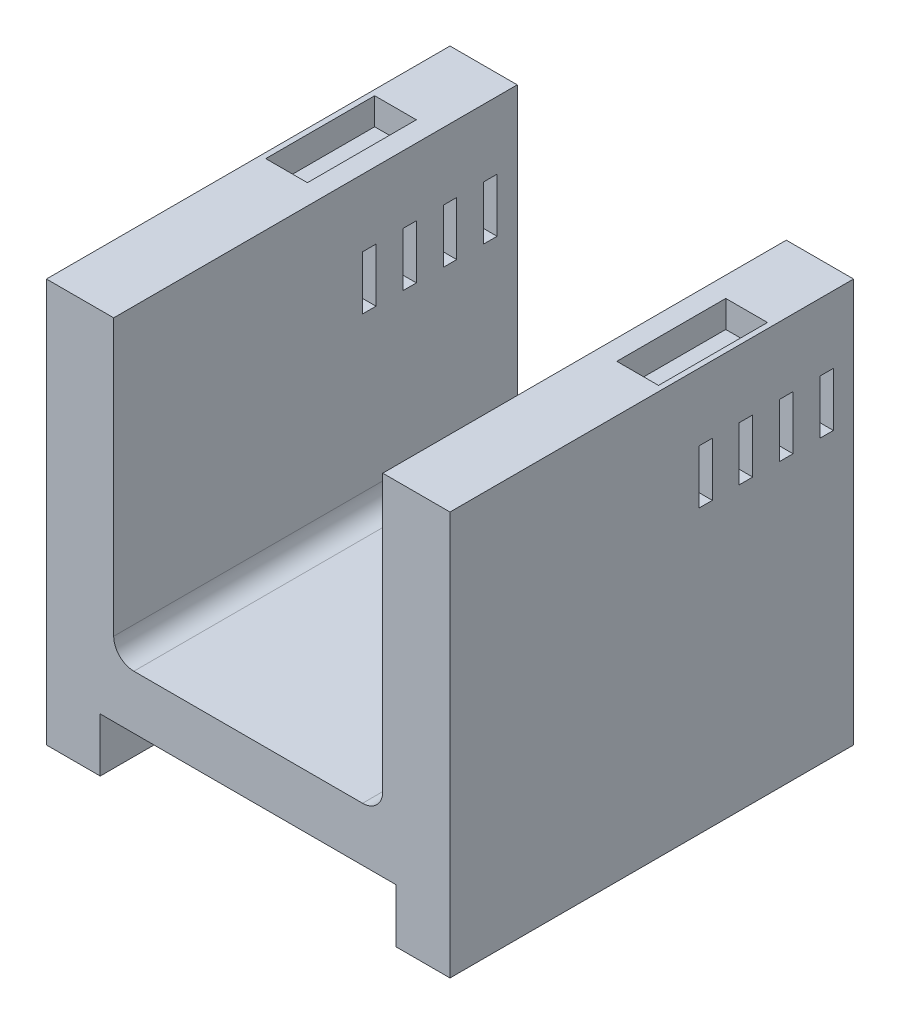
from build123d import *

# Parameters (mm, degrees)
SKETCH1_W           = 150
SKETCH1_H           = 150
BOSS_EXTRUDE2_DEPTH = 75
SKETCH2_W           = 110
SKETCH2_H           = 20
SKETCH2_W_2         = 100
SKETCH2_H_2         = 110
CUT_EXTRUDE1_DEPTH  = 150
SKETCH3_W           = 15.5
SKETCH3_H           = 40.5
CUT_EXTRUDE2_DEPTH  = 10
FILLET1_R           = 7.5
SKETCH4_W           = 5
SKETCH4_H           = 20
CUT_EXTRUDE3_DEPTH  = 140
CUT_EXTRUDE4_DEPTH  = 1


with BuildPart() as part:
    # Sketch1 → Boss-Extrude2 (new, symmetric)
    with BuildSketch(Plane.XY):
        Rectangle(SKETCH1_W, SKETCH1_H)
    extrude(amount=BOSS_EXTRUDE2_DEPTH, both=True)

    # Sketch2 → Cut-Extrude1 (cut)
    with BuildSketch(Plane.XY.offset(75)):
        with Locations((0, -65)):
            Rectangle(SKETCH2_W, SKETCH2_H)
        with Locations((0, 20)):
            Rectangle(SKETCH2_W_2, SKETCH2_H_2)
    extrude(amount=-CUT_EXTRUDE1_DEPTH, mode=Mode.SUBTRACT)

    # Sketch3 → Cut-Extrude2 (cut)
    with BuildSketch(Plane(origin=(0, 75, 0), x_dir=(1, 0, 0), z_dir=(0, 1, 0))):
        with Locations((-65.25, 24.75)):
            Rectangle(SKETCH3_W, SKETCH3_H)
        with Locations((65.25, 24.75)):
            Rectangle(SKETCH3_W, SKETCH3_H)
    extrude(amount=-CUT_EXTRUDE2_DEPTH, mode=Mode.SUBTRACT)

    # Fillet1
    fillet1_edges = [part.edges().sort_by_distance(p)[0] for p in [
        (-50, -35, 0),
        (50, -35, 0),
    ]]
    fillet(fillet1_edges, radius=FILLET1_R)

    # Sketch4 → Cut-Extrude3 (cut)
    with BuildSketch(Plane(origin=(75, 0, 0), x_dir=(0, 0, -1), z_dir=(1, 0, 0))):
        with Locations((50, 40)):
            Rectangle(SKETCH4_W, SKETCH4_H)
        with Locations((65, 40)):
            Rectangle(SKETCH4_W, SKETCH4_H)
        with Locations((35, 40)):
            Rectangle(SKETCH4_W, SKETCH4_H)
        with Locations((20, 40)):
            Rectangle(SKETCH4_W, SKETCH4_H)
    extrude(amount=-CUT_EXTRUDE3_DEPTH, mode=Mode.SUBTRACT)

    # Sketch5 → Cut-Extrude4 (cut)
    # profile 1 of 3: a face of its own
    with BuildSketch(Plane.ZY.offset(75)):
        with BuildLine():
            Line((-3.541666667, 5.069444444), (-3.402777778, 3.333333333))
            Line((-3.402777778, 3.333333333), (-3.541666667, 3.333333333))
            add(Edge.make_bspline(
                [(-3.541666667, 3.333333333), (-3.560127797, 3.399019648), (-3.595893554, 3.526277332), (-3.659666525, 3.708188694), (-3.72687542, 3.876622986), (-3.80227413, 4.030002755), (-3.882169582, 4.169862856), (-3.969191355, 4.294933132), (-4.061446842, 4.406359345), (-4.159647569, 4.503713276), (-4.263693084, 4.587758073), (-4.372377784, 4.660574141), (-4.485902518, 4.72297205), (-4.604543404, 4.774290321), (-4.728887016, 4.813670152), (-4.858484508, 4.839782023), (-4.992585977, 4.858539417), (-5.083844223, 4.860244724), (-5.130208333, 4.861111111)],
                knots=[0, 0, 0, 0, 1.365306606, 2.645083058, 3.856296657, 4.992683601, 6.063002854, 7.077131597, 8.038305781, 8.954596039, 9.839848101, 10.711227855, 11.569763097, 12.429061007, 13.294496621, 14.174761977, 15.072680662, 16, 16, 16, 16], degree=3))
            add(Edge.make_bspline(
                [(-5.130208333, 4.861111111), (-5.169287844, 4.860089442), (-5.246507093, 4.858070671), (-5.360883492, 4.847678613), (-5.472048479, 4.8275014), (-5.580824898, 4.801086562), (-5.686129552, 4.764183666), (-5.789791277, 4.722690801), (-5.889530348, 4.671063555), (-5.986658971, 4.612448815), (-6.079895988, 4.545370393), (-6.168442528, 4.469056114), (-6.250695552, 4.382880321), (-6.328676248, 4.287686666), (-6.400174828, 4.182334195), (-6.469732236, 4.069550336), (-6.530813132, 3.945799573), (-6.588653986, 3.813990541), (-6.639210104, 3.672821607), (-6.683765793, 3.523606878), (-6.721903181, 3.366486083), (-6.751481957, 3.200376693), (-6.777442138, 3.026490305), (-6.79218997, 2.843423536), (-6.804207347, 2.652791522), (-6.805100567, 2.522808163), (-6.805555556, 2.456597222)],
                knots=[0, 0, 0, 0, 0.852545564, 1.684589362, 2.501652392, 3.314783632, 4.123040609, 4.933143274, 5.748109165, 6.569312519, 7.405645712, 8.25016084, 9.114918083, 10.000754889, 10.930732154, 11.889927012, 12.888317242, 13.937610583, 15.028084188, 16.156171809, 17.332859433, 18.552090647, 19.835038534, 21.165583881, 22.556204723, 24, 24, 24, 24], degree=3))
            add(Edge.make_bspline(
                [(-6.805555556, 2.456597222), (-6.804946869, 2.401605833), (-6.803748531, 2.293342773), (-6.793819055, 2.134039228), (-6.777574592, 1.980162537), (-6.754944485, 1.832039691), (-6.726034828, 1.689130362), (-6.688544954, 1.552541535), (-6.646524944, 1.420863258), (-6.598146101, 1.294702841), (-6.541430788, 1.175857854), (-6.479663213, 1.062934068), (-6.410200288, 0.957804512), (-6.33376384, 0.859723869), (-6.2514189, 0.768334354), (-6.162155265, 0.684467281), (-6.066030391, 0.608356468), (-5.964210791, 0.538953857), (-5.856940358, 0.477090531), (-5.745110622, 0.42395381), (-5.629592775, 0.379544139), (-5.510746875, 0.342424594), (-5.388278397, 0.313039481), (-5.261719437, 0.292415184), (-5.131523556, 0.28051361), (-5.043426681, 0.278696094), (-4.998914931, 0.277777778)],
                knots=[0, 0, 0, 0, 1.236646645, 2.434620225, 3.588021171, 4.71542926, 5.803413575, 6.864987612, 7.89909351, 8.911178466, 9.900886288, 10.858450138, 11.803739474, 12.731186558, 13.652621421, 14.567606934, 15.482266978, 16.407285251, 17.336514176, 18.264317902, 19.188799549, 20.117565524, 21.062609844, 22.018756131, 22.998958452, 24, 24, 24, 24], degree=3))
            add(Edge.make_bspline(
                [(-4.998914931, 0.277777778), (-4.922799118, 0.27985346), (-4.773966265, 0.283912139), (-4.557884156, 0.321965574), (-4.355251978, 0.382410079), (-4.196194366, 0.454594439), (-4.074860643, 0.528837328), (-3.980806535, 0.595266272), (-3.885754729, 0.675090232), (-3.787987089, 0.766393808), (-3.688371129, 0.870218925), (-3.584882083, 0.98478028), (-3.481463369, 1.113194093), (-3.413030322, 1.203524539), (-3.377821181, 1.25)],
                knots=[0, 0, 0, 0, 1.384369864, 2.706923932, 3.979392615, 5.225429667, 5.872362172, 6.566477539, 7.319183729, 8.12964106, 9.000244434, 9.937306366, 10.938733914, 12, 12, 12, 12], degree=3))
            Line((-3.377821181, 1.25), (-3.263888889, 1.180555556))
            add(Edge.make_bspline(
                [(-3.263888889, 1.180555556), (-3.294546158, 1.128200251), (-3.354758755, 1.025371494), (-3.450927393, 0.878788128), (-3.55209564, 0.743650218), (-3.657845328, 0.619982896), (-3.765604923, 0.50561585), (-3.87846188, 0.403169075), (-3.994014584, 0.310265407), (-4.115519049, 0.229998829), (-4.240729684, 0.158779484), (-4.371892922, 0.097914464), (-4.508197793, 0.045983661), (-4.65027668, 0.003201252), (-4.79839671, -0.028918323), (-4.951989518, -0.052770644), (-5.111480349, -0.067307385), (-5.219514938, -0.068723437), (-5.274522569, -0.069444444)],
                knots=[0, 0, 0, 0, 1.164115463, 2.286388121, 3.362177995, 4.401064794, 5.407448869, 6.375280312, 7.323730291, 8.2496411, 9.166480924, 10.085577234, 11.021398032, 11.963401182, 12.930012424, 13.927332932, 14.944666635, 16, 16, 16, 16], degree=3))
            add(Edge.make_bspline(
                [(-5.274522569, -0.069444444), (-5.324096727, -0.068939471), (-5.421921899, -0.067943003), (-5.56638095, -0.056433326), (-5.706963831, -0.039400567), (-5.843346858, -0.014912775), (-5.975062745, 0.018821425), (-6.103441395, 0.055248247), (-6.226329856, 0.103260215), (-6.34551672, 0.155678457), (-6.460321814, 0.216030543), (-6.571088451, 0.283093113), (-6.67730899, 0.358244506), (-6.779457497, 0.439774501), (-6.8776781, 0.527806327), (-6.97092707, 0.624023559), (-7.061207281, 0.726269572), (-7.116361323, 0.799674584), (-7.144097222, 0.836588542)],
                knots=[0, 0, 0, 0, 1.099867591, 2.170379506, 3.21370673, 4.241732154, 5.242319988, 6.230208013, 7.200627964, 8.167156574, 9.118536317, 10.076596279, 11.038581839, 12.003776478, 12.975622664, 13.963217193, 14.975741399, 16, 16, 16, 16], degree=3))
            add(Edge.make_bspline(
                [(-7.144097222, 0.836588542), (-7.183857385, 0.893424339), (-7.26281022, 1.006284724), (-7.362425055, 1.187483556), (-7.448602812, 1.374660437), (-7.518173052, 1.570481454), (-7.572699945, 1.773254504), (-7.609753065, 1.98391273), (-7.635082512, 2.201351616), (-7.637607909, 2.349100898), (-7.638888889, 2.424045139)],
                knots=[0, 0, 0, 0, 0.983524538, 1.953011393, 2.929009533, 3.904562341, 4.897931762, 5.904535192, 6.937097918, 8, 8, 8, 8], degree=3))
            add(Edge.make_bspline(
                [(-7.638888889, 2.424045139), (-7.637679207, 2.484833363), (-7.635285467, 2.605122268), (-7.621247854, 2.783806287), (-7.596600728, 2.958574943), (-7.559908779, 3.129255315), (-7.516117843, 3.297044039), (-7.46041206, 3.460671155), (-7.395373082, 3.620557223), (-7.320272394, 3.775410285), (-7.237642662, 3.92500264), (-7.144913191, 4.065712289), (-7.04625044, 4.198839844), (-6.939602001, 4.32281792), (-6.825427191, 4.438161898), (-6.703584062, 4.544769734), (-6.574112032, 4.642636436), (-6.437727993, 4.731393969), (-6.295683506, 4.810181586), (-6.150286975, 4.880080499), (-6.001229025, 4.938775426), (-5.848947954, 4.986646752), (-5.693731323, 5.02359376), (-5.535240941, 5.049360935), (-5.373637229, 5.066445014), (-5.264438885, 5.068439504), (-5.209418403, 5.069444444)],
                knots=[0, 0, 0, 0, 1.092083487, 2.161035764, 3.217773312, 4.260190825, 5.295679875, 6.331270849, 7.362920202, 8.394590017, 9.421399, 10.430623911, 11.419565072, 12.396371527, 13.365824252, 14.332813307, 15.302266032, 16.279072486, 17.253498857, 18.218389939, 19.175218244, 20.128753647, 21.083815363, 22.038788663, 23.011827579, 24, 24, 24, 24], degree=3))
            add(Edge.make_bspline(
                [(-5.209418403, 5.069444444), (-5.123169974, 5.06703775), (-4.950105444, 5.062208521), (-4.692543025, 5.019769592), (-4.436087364, 4.95468338), (-4.270952685, 4.889697558), (-4.187282986, 4.856770833)],
                knots=[0, 0, 0, 0, 0.984356359, 1.975191602, 2.974079167, 4, 4, 4, 4], degree=3))
            add(Edge.make_bspline(
                [(-4.187282986, 4.856770833), (-4.164592539, 4.84711199), (-4.122843604, 4.829340352), (-4.064997545, 4.808783687), (-4.017502596, 4.795351201), (-3.98913298, 4.792784381), (-3.976779514, 4.791666667)],
                knots=[0, 0, 0, 0, 1.336236462, 2.458587416, 3.328796419, 4, 4, 4, 4], degree=3))
            add(Edge.make_bspline(
                [(-3.976779514, 4.791666667), (-3.94627596, 4.793899801), (-3.886010248, 4.798311792), (-3.835639453, 4.831634094), (-3.810763889, 4.848090278)],
                knots=[0, 0, 0, 0, 1.012302122, 2, 2, 2, 2], degree=3))
            add(Edge.make_bspline(
                [(-3.810763889, 4.848090278), (-3.79608402, 4.862065295), (-3.766097958, 4.890611581), (-3.731233143, 4.943688415), (-3.700766592, 5.00312141), (-3.68747169, 5.046748972), (-3.680555556, 5.069444444)],
                knots=[0, 0, 0, 0, 0.931295945, 1.90232619, 2.908770141, 4, 4, 4, 4], degree=3))
            Line((-3.680555556, 5.069444444), (-3.541666667, 5.069444444))
        make_face()
    # profile 2 of 3: a face of its own
    with BuildSketch(Plane.ZY.offset(75)):
        with BuildLine():
            Line((0.553385417, 1.666666667), (-1.439887153, 1.666666667))
            Line((-1.439887153, 1.666666667), (-1.805555556, 0.87890625))
            add(Edge.make_bspline(
                [(-1.805555556, 0.87890625), (-1.824230869, 0.834270326), (-1.858675129, 0.751944998), (-1.897877851, 0.635356662), (-1.924655467, 0.53685188), (-1.928595018, 0.476103923), (-1.930338542, 0.44921875)],
                knots=[0, 0, 0, 0, 1.290094603, 2.37941668, 3.282779777, 4, 4, 4, 4], degree=3))
            add(Edge.make_bspline(
                [(-1.930338542, 0.44921875), (-1.92925002, 0.430544653), (-1.927086893, 0.393435217), (-1.904089803, 0.340600358), (-1.870066397, 0.291462139), (-1.830963184, 0.253745589), (-1.790534833, 0.227446196), (-1.751595142, 0.20873886), (-1.704562511, 0.192741133), (-1.649556642, 0.17936528), (-1.586981319, 0.166198263), (-1.51688411, 0.153936637), (-1.438509503, 0.146056707), (-1.383829045, 0.141349163), (-1.355251736, 0.138888889)],
                knots=[0, 0, 0, 0, 0.928346294, 1.844823155, 2.832693264, 3.906787277, 4.533555799, 5.236980931, 6.060283213, 7.011752617, 8.064797478, 9.256587662, 10.566227436, 12, 12, 12, 12], degree=3))
            Line((-1.355251736, 0.138888889), (-1.355251736, 0))
            Line((-1.355251736, 0), (-2.925347222, 0))
            Line((-2.925347222, 0), (-2.925347222, 0.138888889))
            add(Edge.make_bspline(
                [(-2.925347222, 0.138888889), (-2.87777174, 0.148641637), (-2.791273973, 0.16637327), (-2.676142756, 0.200451126), (-2.58668341, 0.2382559), (-2.542172289, 0.273345832), (-2.522786458, 0.288628472)],
                knots=[0, 0, 0, 0, 1.341417684, 2.438853554, 3.320077337, 4, 4, 4, 4], degree=3))
            add(Edge.make_bspline(
                [(-2.522786458, 0.288628472), (-2.50658002, 0.305734104), (-2.472102733, 0.342124319), (-2.423141844, 0.406084632), (-2.373699828, 0.482203687), (-2.323078756, 0.570084331), (-2.270790897, 0.669709093), (-2.216817202, 0.780616703), (-2.162536998, 0.904331821), (-2.126914148, 0.990953871), (-2.108289931, 1.036241319)],
                knots=[0, 0, 0, 0, 0.657509844, 1.398774721, 2.244567789, 3.190193186, 4.229071695, 5.385194885, 6.63293641, 8, 8, 8, 8], degree=3))
            Line((-2.108289931, 1.036241319), (-0.233289931, 5.069444444))
            Line((-0.233289931, 5.069444444), (-0.096571181, 5.069444444))
            Line((-0.096571181, 5.069444444), (1.597222222, 0.948350694))
            add(Edge.make_bspline(
                [(1.597222222, 0.948350694), (1.613860368, 0.908763224), (1.645859565, 0.8326269), (1.697738836, 0.725542754), (1.745503316, 0.627837005), (1.793519951, 0.541774576), (1.839955181, 0.466614861), (1.885412105, 0.402298008), (1.929683964, 0.348566682), (1.988010143, 0.291545086), (2.069103635, 0.23385532), (2.182244256, 0.185997065), (2.310467224, 0.151590625), (2.402112277, 0.143253318), (2.450086806, 0.138888889)],
                knots=[0, 0, 0, 0, 1.223989839, 2.354029848, 3.391605643, 4.324042249, 5.162387765, 5.909171864, 6.567979791, 7.144041755, 8.231258465, 9.380841669, 10.628917946, 12, 12, 12, 12], degree=3))
            Line((2.450086806, 0.138888889), (2.450086806, 0))
            Line((2.450086806, 0), (0.476345486, 0))
            Line((0.476345486, 0), (0.476345486, 0.138888889))
            add(Edge.make_bspline(
                [(0.476345486, 0.138888889), (0.522049976, 0.141824368), (0.606024478, 0.14721783), (0.719030328, 0.169038273), (0.809780901, 0.196150186), (0.876855371, 0.236457974), (0.924319725, 0.284052367), (0.957621621, 0.335863297), (0.978422108, 0.392733035), (0.980790299, 0.432410056), (0.981987847, 0.452473958)],
                knots=[0, 0, 0, 0, 1.654818352, 3.040457217, 4.157564338, 5.061856313, 5.838989301, 6.56851638, 7.276126429, 8, 8, 8, 8], degree=3))
            add(Edge.make_bspline(
                [(0.981987847, 0.452473958), (0.980038239, 0.484446256), (0.975594755, 0.557316492), (0.943177106, 0.676865048), (0.898558521, 0.821007303), (0.857661232, 0.923307415), (0.835503472, 0.978732639)],
                knots=[0, 0, 0, 0, 0.698820548, 1.592729354, 2.695763756, 4, 4, 4, 4], degree=3))
            Line((0.835503472, 0.978732639), (0.553385417, 1.666666667))
        make_face()
        Polygon((0.467664931, 1.875), (-0.381944444, 3.882378472), (-1.343315972, 1.875), align=None, mode=Mode.SUBTRACT)
    # profile 3 of 3: a face of its own
    with BuildSketch(Plane.ZY.offset(75)):
        with BuildLine():
            Line((2.569444444, 0), (2.569444444, 0.138888889))
            Line((2.569444444, 0.138888889), (2.750651042, 0.138888889))
            add(Edge.make_bspline(
                [(2.750651042, 0.138888889), (2.775279414, 0.139470136), (2.822934507, 0.14059483), (2.891719334, 0.150464302), (2.955082596, 0.166667026), (3.013066457, 0.189038716), (3.064518238, 0.219421682), (3.112167037, 0.253570209), (3.152665345, 0.296770037), (3.174633003, 0.329535222), (3.185763889, 0.346137153)],
                knots=[0, 0, 0, 0, 1.170016541, 2.263943595, 3.293731011, 4.273677885, 5.205400736, 6.126759273, 7.050839703, 8, 8, 8, 8], degree=3))
            add(Edge.make_bspline(
                [(3.185763889, 0.346137153), (3.192233993, 0.357923738), (3.206477371, 0.383870895), (3.222184583, 0.43001288), (3.234544886, 0.485396026), (3.245515106, 0.550230255), (3.253685032, 0.624507732), (3.260519051, 0.70879714), (3.263219646, 0.802572191), (3.263659404, 0.868417057), (3.263888889, 0.902777778)],
                knots=[0, 0, 0, 0, 0.568141805, 1.250715472, 2.052584266, 2.968455247, 4.031571596, 5.213625719, 6.545948453, 8, 8, 8, 8], degree=3))
            Line((3.263888889, 0.902777778), (3.263888889, 4.097222222))
            add(Edge.make_bspline(
                [(3.263888889, 4.097222222), (3.263939844, 4.135211574), (3.264036478, 4.207256974), (3.257815317, 4.309974656), (3.251005434, 4.401645773), (3.240368143, 4.482102399), (3.226502492, 4.551503747), (3.209226597, 4.609412995), (3.190986458, 4.658121421), (3.172541565, 4.683451378), (3.1640625, 4.695095486)],
                knots=[0, 0, 0, 0, 1.484107705, 2.814555366, 4.019988359, 5.075390106, 5.984573864, 6.780592097, 7.4394417, 8, 8, 8, 8], degree=3))
            add(Edge.make_bspline(
                [(3.1640625, 4.695095486), (3.139179083, 4.720769101), (3.08915632, 4.772380387), (2.99050509, 4.824963958), (2.875796819, 4.855284584), (2.793897101, 4.859097665), (2.750651042, 4.861111111)],
                knots=[0, 0, 0, 0, 0.928124107, 1.865794122, 2.873060895, 4, 4, 4, 4], degree=3))
            Line((2.750651042, 4.861111111), (2.569444444, 4.861111111))
            Line((2.569444444, 4.861111111), (2.569444444, 5))
            Line((2.569444444, 5), (4.618055556, 5))
            add(Edge.make_bspline(
                [(4.618055556, 5), (4.709215818, 4.999143286), (4.886191622, 4.997480087), (5.143131079, 4.985368329), (5.383558185, 4.966512035), (5.606593673, 4.938520283), (5.81297945, 4.902619962), (6.002805026, 4.860181466), (6.175757832, 4.808220383), (6.333132195, 4.747911984), (6.478950498, 4.678802027), (6.615342431, 4.598211044), (6.74488344, 4.507954507), (6.867563969, 4.407511187), (6.982057595, 4.29558276), (7.090192138, 4.173680556), (7.189959838, 4.040417353), (7.282847513, 3.898228279), (7.366406443, 3.747439541), (7.439022795, 3.589939165), (7.500936181, 3.426766986), (7.552365307, 3.257994763), (7.591410844, 3.083128512), (7.617611172, 2.902433124), (7.636297706, 2.716317475), (7.638016417, 2.590109006), (7.638888889, 2.526041667)],
                knots=[0, 0, 0, 0, 1.467398357, 2.848763231, 4.139747069, 5.348651221, 6.465709142, 7.510884705, 8.477890948, 9.369935066, 10.221521294, 11.072291092, 11.917022873, 12.760911509, 13.621447043, 14.491775058, 15.381421868, 16.298684439, 17.223858558, 18.153856654, 19.088127867, 20.031156851, 20.991691223, 21.969088183, 22.969046064, 24, 24, 24, 24], degree=3))
            add(Edge.make_bspline(
                [(7.638888889, 2.526041667), (7.637206894, 2.440583668), (7.633910105, 2.273082068), (7.602258339, 2.02735756), (7.552818592, 1.792360443), (7.483441138, 1.56755566), (7.392924594, 1.353956264), (7.282238983, 1.151294953), (7.154063172, 0.957494742), (7.05213786, 0.840233822), (7.000868056, 0.78125)],
                knots=[0, 0, 0, 0, 1.077719575, 2.112379846, 3.120154608, 4.104514829, 5.075810074, 6.041644454, 7.014920789, 8, 8, 8, 8], degree=3))
            add(Edge.make_bspline(
                [(7.000868056, 0.78125), (6.970538358, 0.74936335), (6.909663439, 0.685363463), (6.810744866, 0.596879349), (6.706475699, 0.514136775), (6.596150824, 0.437888252), (6.480273609, 0.367492585), (6.358293029, 0.303039293), (6.229963595, 0.246089109), (6.096591667, 0.193599574), (5.956931753, 0.148259958), (5.811844638, 0.108031889), (5.660470902, 0.074288194), (5.503191717, 0.047724008), (5.340393619, 0.0256958), (5.171679171, 0.010655104), (4.997196497, 0.002101176), (4.878843233, 0.000707248), (4.818793403, 0)],
                knots=[0, 0, 0, 0, 0.884547214, 1.775380039, 2.665826882, 3.559504879, 4.469980105, 5.390593375, 6.331323642, 7.291529335, 8.271228182, 9.282197471, 10.317896576, 11.387954191, 12.488469157, 13.620281033, 14.792583212, 16, 16, 16, 16], degree=3))
            Line((4.818793403, 0), (2.569444444, 0))
        make_face()
        with BuildLine():
            add(Edge.make_bspline(
                [(3.958333333, 0.314670139), (4.035221917, 0.298273802), (4.181921261, 0.26699046), (4.393972778, 0.235444417), (4.586085249, 0.212364085), (4.708058188, 0.209625735), (4.765625, 0.208333333)],
                knots=[0, 0, 0, 0, 1.156263879, 2.206090244, 3.153339526, 4, 4, 4, 4], degree=3))
            add(Edge.make_bspline(
                [(4.765625, 0.208333333), (4.83734737, 0.210121917), (4.978513977, 0.213642274), (5.185234016, 0.244027053), (5.383178125, 0.291375608), (5.571739606, 0.358864928), (5.750746707, 0.446202074), (5.919997702, 0.553153713), (6.078681198, 0.680412577), (6.228598684, 0.823803236), (6.363423151, 0.985319036), (6.482823049, 1.160780615), (6.582726881, 1.350596087), (6.664236379, 1.553998865), (6.72848522, 1.77081022), (6.773471295, 2.001871189), (6.801105547, 2.246502604), (6.80404946, 2.414204372), (6.805555556, 2.5)],
                knots=[0, 0, 0, 0, 0.997996022, 1.964292496, 2.902202989, 3.827540679, 4.746320531, 5.669683403, 6.608607029, 7.573643287, 8.552931756, 9.531909504, 10.522958759, 11.532773866, 12.577887131, 13.666093008, 14.805981493, 16, 16, 16, 16], degree=3))
            add(Edge.make_bspline(
                [(6.805555556, 2.5), (6.804052965, 2.586517745), (6.801121648, 2.755300207), (6.773594595, 3.001039925), (6.728328192, 3.232764515), (6.664223691, 3.450313775), (6.582945968, 3.654552824), (6.483069847, 3.844445231), (6.363449682, 4.019111092), (6.22814677, 4.179386682), (6.078871145, 4.323594647), (5.917650566, 4.449041171), (5.745816666, 4.554947854), (5.56406163, 4.642901831), (5.370423208, 4.708010295), (5.168126341, 4.757861955), (4.954853474, 4.78595614), (4.80946801, 4.789736596), (4.735243056, 4.791666667)],
                knots=[0, 0, 0, 0, 1.193396302, 2.328127765, 3.406675227, 4.447298146, 5.452780722, 6.435033879, 7.401194227, 8.367973033, 9.324444072, 10.259799173, 11.180785527, 12.104889921, 13.03919269, 13.994204462, 14.975963072, 16, 16, 16, 16], degree=3))
            add(Edge.make_bspline(
                [(4.735243056, 4.791666667), (4.67659607, 4.790377429), (4.554626865, 4.787696178), (4.366166158, 4.765767533), (4.165586717, 4.730797543), (4.029074854, 4.698705172), (3.958333333, 4.682074653)],
                knots=[0, 0, 0, 0, 0.894670856, 1.860663297, 2.891378894, 4, 4, 4, 4], degree=3))
            Line((3.958333333, 4.682074653), (3.958333333, 0.314670139))
        make_face(mode=Mode.SUBTRACT)
    extrude(amount=-CUT_EXTRUDE4_DEPTH, mode=Mode.SUBTRACT)


solid = part.part
